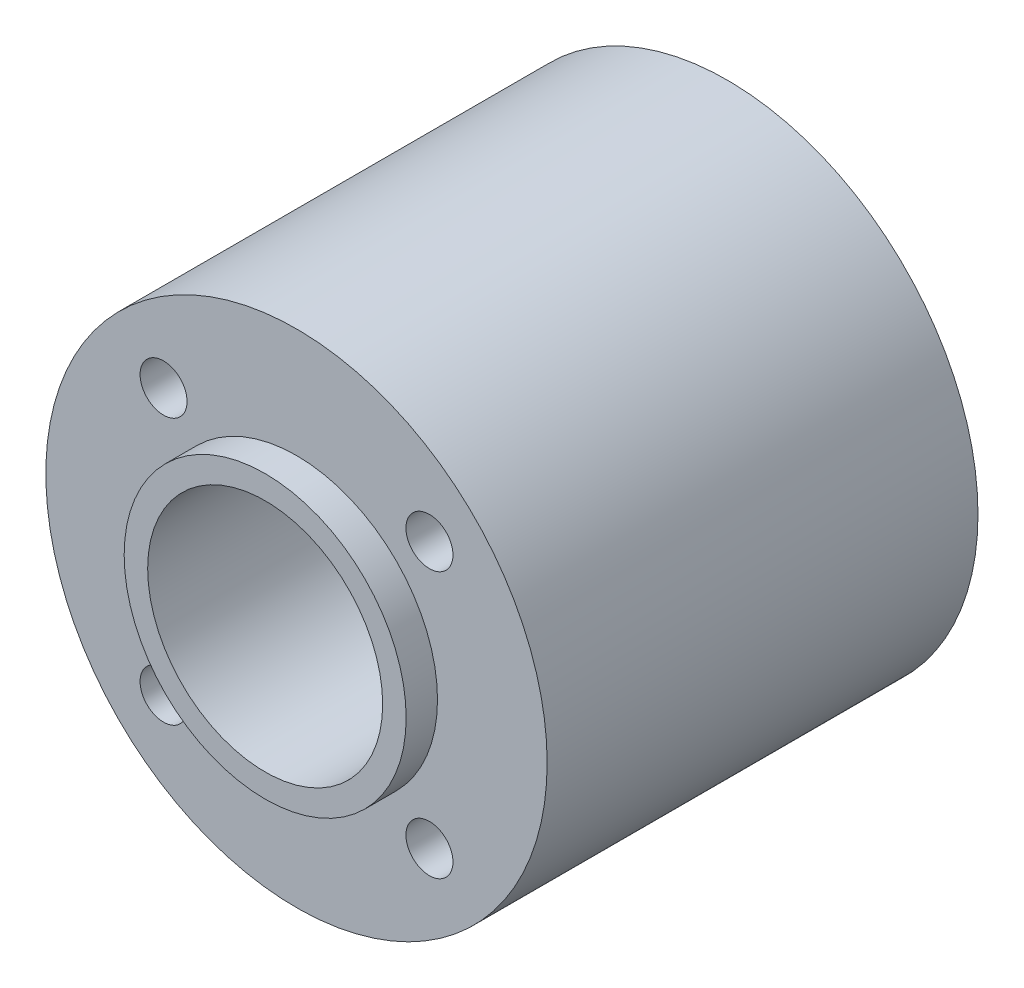
from build123d import *

# Parameters (mm, degrees)
IZIM1_R                          = 16
IZIM1_R_2                        = 9
IZIM1_R_3                        = 1.5
IZIM1_R_4                        = 7.5
Y_KSEKLIK_EKSTR_ZYON1_DEPTH      = 27.5
Y_KSEKLIK_EKSTR_ZYON2_DEPTH      = 2
Y_KSEKLIK_EKSTR_ZYON2_DEPTH_BACK = 29.5
IZIM2_R                          = 9
IZIM2_R_2                        = 7.5


with BuildPart() as part:
    # Çizim1 → Yükseklik-Ekstrüzyon1 (new body)
    # profile 1 of 2: a face of its own
    with BuildSketch(Plane.XY):
        Circle(IZIM1_R)
        Circle(IZIM1_R_2, mode=Mode.SUBTRACT)
        with Locations((-8.485281374, -8.485281374)):
            Circle(IZIM1_R_3, mode=Mode.SUBTRACT)
        with Locations((8.485281374, -8.485281374)):
            Circle(IZIM1_R_3, mode=Mode.SUBTRACT)
        with Locations((8.485281374, 8.485281374)):
            Circle(IZIM1_R_3, mode=Mode.SUBTRACT)
        with Locations((-8.485281374, 8.485281374)):
            Circle(IZIM1_R_3, mode=Mode.SUBTRACT)
    # profile 2 of 2: a face of its own
    with BuildSketch(Plane.XY):
        Circle(IZIM1_R_2)
        Circle(IZIM1_R_4, mode=Mode.SUBTRACT)
    extrude(amount=Y_KSEKLIK_EKSTR_ZYON1_DEPTH)

    # Çizim2 → Yükseklik-Ekstrüzyon2 (add, two sides: drawn at the far end of the back side and taken through both)
    with BuildSketch(Plane.XY.offset(27.5).offset(-Y_KSEKLIK_EKSTR_ZYON2_DEPTH_BACK)):
        Circle(IZIM2_R)
        Circle(IZIM2_R_2, mode=Mode.SUBTRACT)
    extrude(amount=Y_KSEKLIK_EKSTR_ZYON2_DEPTH + Y_KSEKLIK_EKSTR_ZYON2_DEPTH_BACK)


solid = part.part
